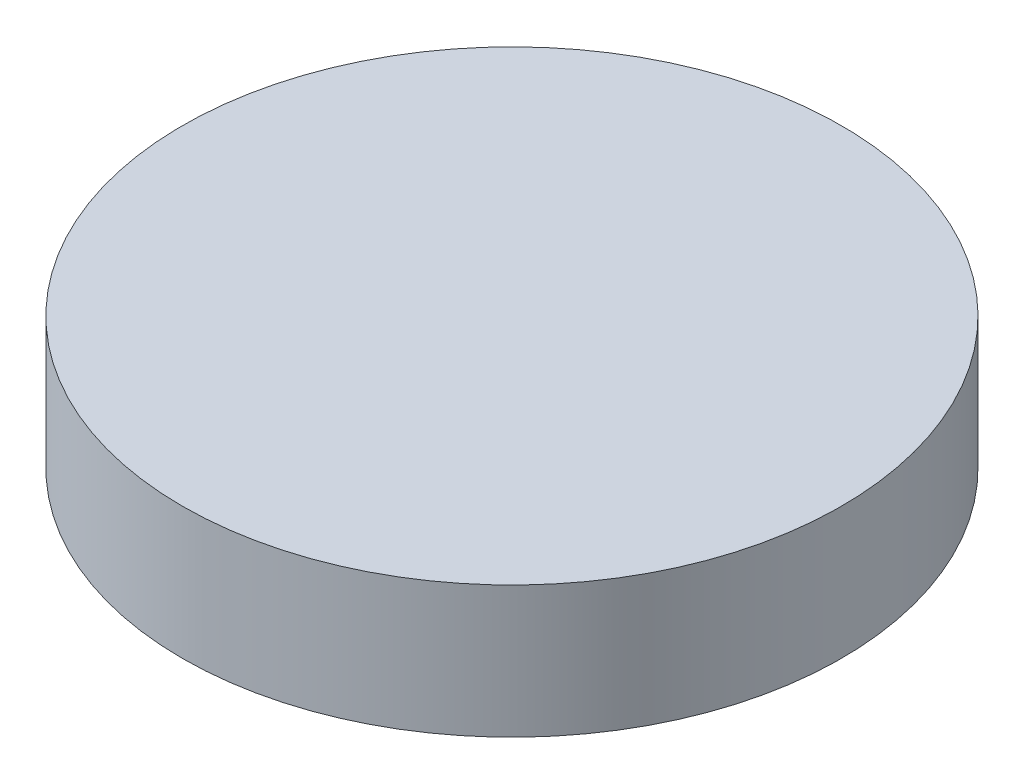
from build123d import *

# Parameters (mm, degrees)
SKETCH2_R           = 2.5
BOSS_EXTRUDE1_DEPTH = 1


with BuildPart() as part:
    # Sketch2 → Boss-Extrude1 (new body)
    with BuildSketch(Plane(origin=(0, 0, 0), x_dir=(1, 0, 0), z_dir=(0, 1, 0))):
        with Locations(Location((0, 0, 0), (0, 0, 270))):
            Circle(SKETCH2_R)
    extrude(amount=BOSS_EXTRUDE1_DEPTH)


solid = part.part
